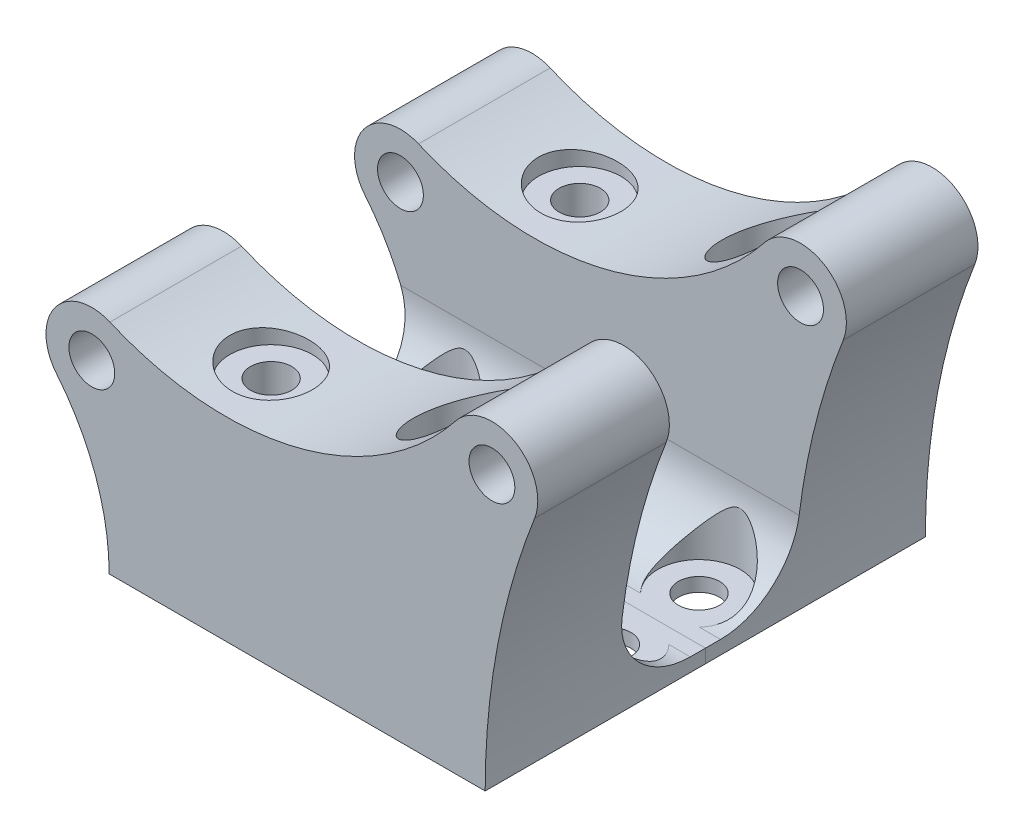
from build123d import *

# Parameters (mm, degrees)
SZKIC1_R                                            = 5
DODANIE_WYCI_GNI_CIE1_DEPTH                         = 28.7
DODANIE_WYCI_GNI_CIE2_REACH                         = 120.092
DODANIE_WYCI_GNI_CIE2_END_RADIUS                    = 50.543324632
WYTNIJ_WYCI_GNI_CIE1_START                          = -19.3
WYTNIJ_WYCI_GNI_CIE1_DEPTH                          = 19.3
POG_BIENIE_WALCOWE_POD_M8_WKR_T_Z_BEM_S_D           = 9
POG_BIENIE_WALCOWE_POD_M8_WKR_T_Z_BEM_S_CBORE_D     = 18.011
POG_BIENIE_WALCOWE_POD_M8_WKR_T_Z_BEM_S_CBORE_DEPTH = 20.3
POG_BIENIE_WALCOWE_POD_M8_WKR_T_Z_B_2_D             = 9
POG_BIENIE_WALCOWE_POD_M8_WKR_T_Z_B_2_CBORE_D       = 18.011
POG_BIENIE_WALCOWE_POD_M8_WKR_T_Z_B_2_CBORE_DEPTH   = 57.54


with BuildPart() as part:
    # Szkic1 → Dodanie-wyciągnięcie1 (new body)
    with BuildSketch(Plane.XY):
        with BuildLine():
            Line((-1.469986393, -60.54), (-83.469986393, -60.54))
            ThreePointArc((-83.469986393, -60.54), (-86.43214098, -43.49124867), (-94.971403209, -28.440824015))
            ThreePointArc((-94.971403209, -28.440824015), (-95.242829308, -16.084497343), (-83.300365534, -12.901724973))
            ThreePointArc((-83.300365534, -12.901724973), (-42.333721248, -16.139046942), (-7.843535904, 6.203139892))
            ThreePointArc((-7.843535904, 6.203139892), (4.984530504, 8.669166953), (9.306965288, -3.657922516))
            ThreePointArc((9.306965288, -3.657922516), (1.248004894, -31.593007814), (-1.469986393, -60.54))
        make_face()
        with Locations((-87.246959259, -22.09)):
            Circle(SZKIC1_R, mode=Mode.SUBTRACT)
        Circle(SZKIC1_R, mode=Mode.SUBTRACT)
    extrude(amount=DODANIE_WYCI_GNI_CIE1_DEPTH)

    # Dodanie-wyciągnięcie2: up to this cylinder (the profile starts outside it)
    dodanie_wyci_gni_cie2_end = Plane(origin=(-134.013311026, -60.54, -6.691691), z_dir=(0, 0, -1)) * Cylinder(DODANIE_WYCI_GNI_CIE2_END_RADIUS, 342.270649265, mode=Mode.PRIVATE)
    # Szkic3 → Dodanie-wyciągnięcie2 (add, up to the surface)
    with BuildSketch(Plane(origin=(0, 0, 0), x_dir=(0, 0, -1), z_dir=(1, 0, 0)), mode=Mode.PRIVATE) as dodanie_wyci_gni_cie2_sk1:
        with BuildLine():
            Line((0, -60.54), (0, -41.54))
            ThreePointArc((0, -41.54), (4.686291501, -52.853708499), (16, -57.54))
            Line((16, -57.54), (19.3, -57.54))
            Line((19.3, -57.54), (19.3, -60.54))
            Line((19.3, -60.54), (0, -60.54))
        make_face()
    dodanie_wyci_gni_cie2_tool1 = extrude(dodanie_wyci_gni_cie2_sk1.sketch, amount=-DODANIE_WYCI_GNI_CIE2_REACH, mode=Mode.PRIVATE) - dodanie_wyci_gni_cie2_end
    add(dodanie_wyci_gni_cie2_tool1.solids().sort_by_distance((0, -56.56965, -6.691691))[0])

    # Szkic4 → Wytnij-wyciągnięcie1 (cut)
    with BuildSketch(Plane.XY.offset(WYTNIJ_WYCI_GNI_CIE1_START)):
        with BuildLine():
            Line((-1.469986393, -60.54), (0, -60.54))
            Line((0, -60.54), (0, -41.54))
            Line((0, -41.54), (-0.304878126, -41.54))
            ThreePointArc((-0.304878126, -41.54), (-1.178436016, -51.022155217), (-1.469986393, -60.54))
        make_face()
    extrude(amount=WYTNIJ_WYCI_GNI_CIE1_DEPTH, mode=Mode.SUBTRACT)

    # Pog_bienie walcowe pod M8 Wkr_t z _bem s (through all)
    with Locations(Plane(origin=(0, 0, 0), x_dir=(1, 0, 0), z_dir=(0, 1, 0))):
        with Locations((-62.500071487, -14.35), (-22.500071487, -14.35)):
            CounterBoreHole(POG_BIENIE_WALCOWE_POD_M8_WKR_T_Z_BEM_S_D / 2, POG_BIENIE_WALCOWE_POD_M8_WKR_T_Z_BEM_S_CBORE_D / 2, POG_BIENIE_WALCOWE_POD_M8_WKR_T_Z_BEM_S_CBORE_DEPTH)

    # Pog_bienie walcowe pod M8 Wkr_t z _b 2 (through all)
    with Locations(Plane(origin=(0, 0, 0), x_dir=(1, 0, 0), z_dir=(0, 1, 0))):
        with Locations((-72.500071487, 9.65), (-12.500071487, 9.65)):
            CounterBoreHole(POG_BIENIE_WALCOWE_POD_M8_WKR_T_Z_B_2_D / 2, POG_BIENIE_WALCOWE_POD_M8_WKR_T_Z_B_2_CBORE_D / 2, POG_BIENIE_WALCOWE_POD_M8_WKR_T_Z_B_2_CBORE_DEPTH)


with BuildPart() as body_2:
    # Lustro2: mirrored copy
    add(part.part.mirror(Plane(origin=(-97.247959259, -57.54, -19.3), x_dir=(1, 0, 0), z_dir=(0, 0, -1))))


solid = Compound([part.part, body_2.part])
